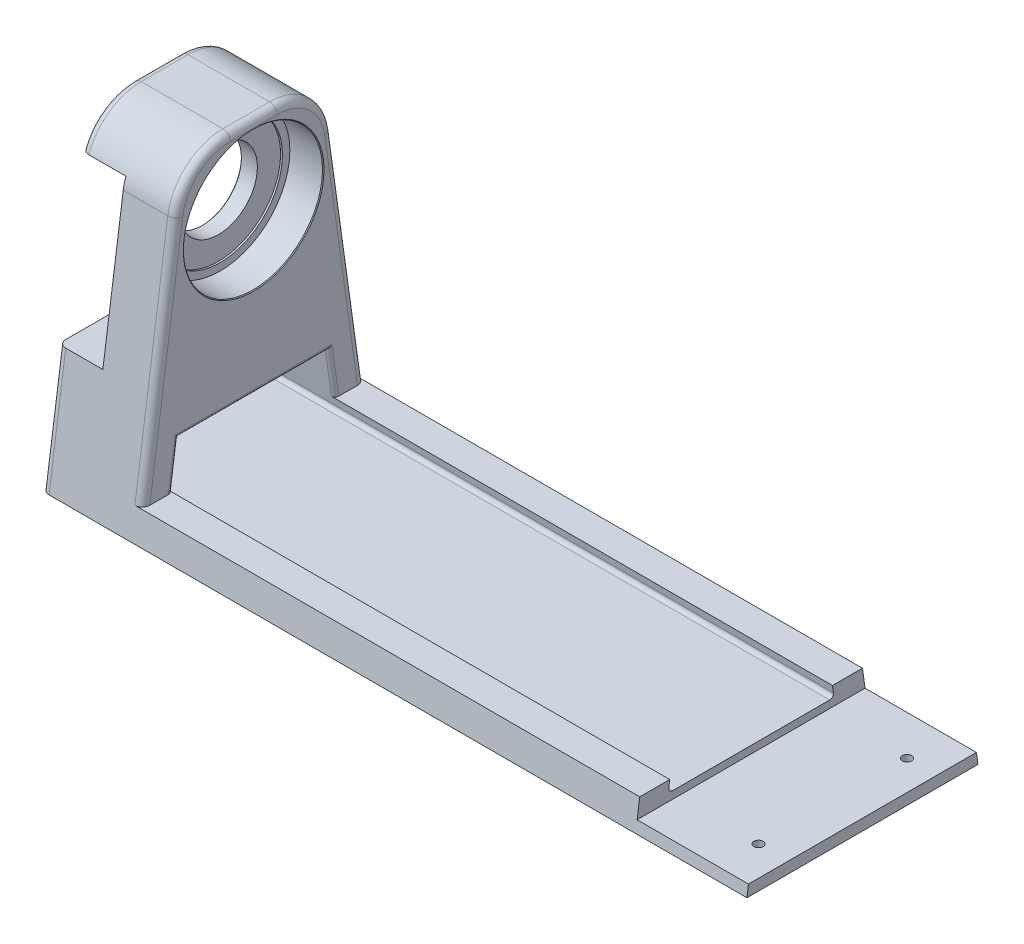
from build123d import *

# Parameters (mm, degrees)
SKETCH_1_W          = 190
SKETCH_1_H          = 60.00000000000001
EXTRUDE_1_DEPTH     = 8
EXTRUDE_2_DEPTH     = 76
SKETCH_3_W          = 29.999999999999986
SKETCH_3_H          = 60
CUT_EXTRUDE_1_DEPTH = 5
DRAFT_1_ANGLE       = 8.000000000000018
EXTRUDE_3_DEPTH     = 12
SKETCH_5_W          = 18.5
SKETCH_5_H          = 6.9999999999999964
CUT_EXTRUDE_2_DEPTH = 2.5
CUT_EXTRUDE_3_DEPTH = 211.0588577307207
SKETCH_7_R          = 18.750000000000007
CUT_EXTRUDE_4_DEPTH = 9
SKETCH_8_R          = 10.499999999999996
CUT_EXTRUDE_5_DEPTH = 195.81715456071922
SKETCH_10_R         = 16.750000000000007
CUT_EXTRUDE_7_DEPTH = 0.5
FILLET_2_R          = 15
FILLET_3_R          = 1
CHAMFER_1_SIZE      = 0.2
FILLET_4_R          = 2
SKETCH_9_R          = 1.2500000000000004
CUT_EXTRUDE_6_DEPTH = 10
SKETCH_11_R         = 1.2499999999999978
CUT_EXTRUDE_9_DEPTH = 129.66516135432758


with BuildPart() as part:
    # 스케치1 → 보스-돌출1 (new body)
    with BuildSketch(Plane(origin=(0, 0, 0), x_dir=(1, 0, 0), z_dir=(0, 1, 0))):
        Rectangle(SKETCH_1_W, SKETCH_1_H)
    extrude(amount=EXTRUDE_1_DEPTH)

    # 스케치2 → 보스-돌출2 (add)
    with BuildSketch(Plane(origin=(0, 8, 0), x_dir=(1, 0, 0), z_dir=(0, 1, 0))):
        Polygon((-68.99999999999997, -29.999999999999993), (-82.99999999999999, -29.999999999999996), (-82.99999999999997, 30), (-68.99999999999997, 30.000000000000004), align=None)
    extrude(amount=EXTRUDE_2_DEPTH)

    # 스케치3 → 컷-돌출1 (cut)
    with BuildSketch(Plane(origin=(0, 8, 0), x_dir=(1, 0, 0), z_dir=(0, 1, 0))):
        with Locations((80, 3.55e-15)):
            Rectangle(SKETCH_3_W, SKETCH_3_H)
    extrude(amount=-CUT_EXTRUDE_1_DEPTH, mode=Mode.SUBTRACT)

    # 구배1
    draft_1_faces = [part.faces().sort_by_distance(p)[0] for p in [
        (1.421e-14, 2.0774022239325727, -30),
        (1.421e-14, 2.0774022239325727, 30),
    ]]
    draft(draft_1_faces, Plane.ZX.offset(8), DRAFT_1_ANGLE)

    # 스케치4 → 보스-돌출3 (add)
    with BuildSketch(Plane.ZY.offset(82.99999999999997)):
        Polygon((-19.318896562618214, 83.99999999999999), (19.318896562618214, 83.99999999999999), (20.724304909642164, 74), (0.7500000000000067, 74), (0.7500000000000067, 80), (-0.7499999999999934, 80), (-0.7499999999999934, 74), (-20.724304909642132, 74), align=None)
        Polygon((0.7500000000000067, 32), (26.627019967142623, 32), (30.000000000000014, 8), (-29.999999999999986, 8), (-26.627019967142584, 32), (-0.7499999999999934, 32), (-0.7499999999999934, 25), (0.7500000000000067, 25), align=None)
    extrude(amount=EXTRUDE_3_DEPTH)

    # 스케치5 → 컷-돌출2 (cut)
    with BuildSketch(Plane.ZY.offset(94.99999999999999)):
        Polygon((-9.25, 80), (9.25, 80.00000000000001), (9.250000000000002, 74), (-9.249999999999998, 74), align=None)
        with Locations((-1.78e-15, 28.5)):
            Rectangle(SKETCH_5_W, SKETCH_5_H)
    extrude(amount=-CUT_EXTRUDE_2_DEPTH, mode=Mode.SUBTRACT)

    # 스케치6 → 컷-돌출3 (cut, through all)
    with BuildSketch(Plane.ZY.offset(94.99999999999999)):
        Polygon((-20.234889403422354, 20), (-22.34300192395823, 4.999999999999996), (22.343001923958226, 5.000000000000001), (20.23488940342236, 20), align=None)
    extrude(amount=-CUT_EXTRUDE_3_DEPTH, mode=Mode.SUBTRACT)

    # 스케치7 → 컷-돌출4 (cut)
    with BuildSketch(Plane(origin=(-68.99999999999997, 0, 0), x_dir=(0, 0, -1), z_dir=(1, 0, 0))):
        with Locations((2.22e-15, 62.9)):
            Circle(SKETCH_7_R)
    extrude(amount=-CUT_EXTRUDE_4_DEPTH, mode=Mode.SUBTRACT)

    # 스케치8 → 컷-돌출5 (cut, through all)
    with BuildSketch(Plane(origin=(-77.99999999999997, 0, 0), x_dir=(0, 0, -1), z_dir=(1, 0, 0))):
        with Locations((2.22e-15, 62.9)):
            Circle(SKETCH_8_R)
    extrude(amount=-CUT_EXTRUDE_5_DEPTH, mode=Mode.SUBTRACT)

    # 스케치10 → 컷-돌출7 (cut)
    with BuildSketch(Plane(origin=(-77.99999999999997, 0, 0), x_dir=(0, 0, -1), z_dir=(1, 0, 0))):
        with Locations((2.22e-15, 62.9)):
            Circle(SKETCH_10_R)
    extrude(amount=-CUT_EXTRUDE_7_DEPTH, mode=Mode.SUBTRACT)

    # 필렛2
    fillet_2_edges = [part.edges().sort_by_distance(p)[0] for p in [
        (-81.99999999999997, 84, -19.31889656261823),
        (-81.99999999999997, 84, 19.318896562618217),
    ]]
    fillet(fillet_2_edges, radius=FILLET_2_R)

    # 필렛3
    fillet_3_edges = [part.edges().sort_by_distance(p)[0] for p in [
        (-68.99999999999997, 20, 3.55e-15),
        (-68.99999999999997, 14, 21.078134411636704),
        (-14.999999999999986, 5.000000000000001, 22.343001923958226),
        (-68.99999999999997, 14, -21.078134411636704),
        (-14.999999999999986, 4.999999999999996, -22.34300192395823),
        (-94.99999999999999, 20, 3.55e-15),
        (-94.99999999999999, 12.499999999999998, -21.288945663690292),
        (-94.99999999999999, 4.999999999999998, -3.55e-15),
        (-94.99999999999999, 12.5, 21.288945663690292),
    ]]
    fillet(fillet_3_edges, radius=FILLET_3_R)

    # 모따기1
    chamfer_1_edges = [part.edges().sort_by_distance(p)[0] for p in [
        (-68.99999999999997, 62.9, 18.750000000000004),
        (-82.99999999999999, 62.9, 10.499999999999995),
    ]]
    chamfer(chamfer_1_edges, length=CHAMFER_1_SIZE)

    # 필렛4
    fillet_4_edges = [part.edges().sort_by_distance(p)[0] for p in [
        (-94.99999999999997, 83.99999999999999, -1.365e-14),
        (-68.99999999999997, 84, 0),
        (-68.99999999999997, 39.54379825720049, -25.566808263249197),
        (-68.99999999999997, 39.54379825720049, 25.566808263249193),
        (-68.99999999999999, 80.32064370334157, -16.120480930232446),
        (-68.99999999999999, 80.32064370334157, 16.120480930232446),
        (-94.99999999999999, 81.24744871391589, -14.93984953321921),
        (-94.99999999999999, 81.24744871391587, 14.939849533219187),
        (-94.99999999999997, 16, 28.87567332238087),
        (-94.99999999999999, 16, -28.875673322380862),
    ]]
    fillet(fillet_4_edges, radius=FILLET_4_R)

    # 스케치9 → 컷-돌출6 (cut)
    with BuildSketch(Plane.ZY.offset(92.49999999999999)):
        with Locations((-5.000000000000003, 76.75000000000001)):
            Circle(SKETCH_9_R)
        with Locations((4.999999999999997, 76.75)):
            Circle(SKETCH_9_R)
        with Locations((-4.9999999999999964, 28.150000000000002)):
            Circle(SKETCH_9_R)
        with Locations((5.000000000000004, 28.150000000000002)):
            Circle(SKETCH_9_R)
    extrude(amount=-CUT_EXTRUDE_6_DEPTH, mode=Mode.SUBTRACT)

    # 스케치11 → 컷-돌출9 (cut, through all)
    with BuildSketch(Plane(origin=(0, 3, 0), x_dir=(1, 0, 0), z_dir=(0, 1, 0))):
        with Locations(Location((87.00000000000003, 19.999999999999996, 0), (0, 0, 270))):
            Circle(SKETCH_11_R)
        with Locations(Location((87.00000000000003, -20.000000000000004, 0), (0, 0, 270))):
            Circle(SKETCH_11_R)
    extrude(amount=-CUT_EXTRUDE_9_DEPTH, mode=Mode.SUBTRACT)


solid = part.part
